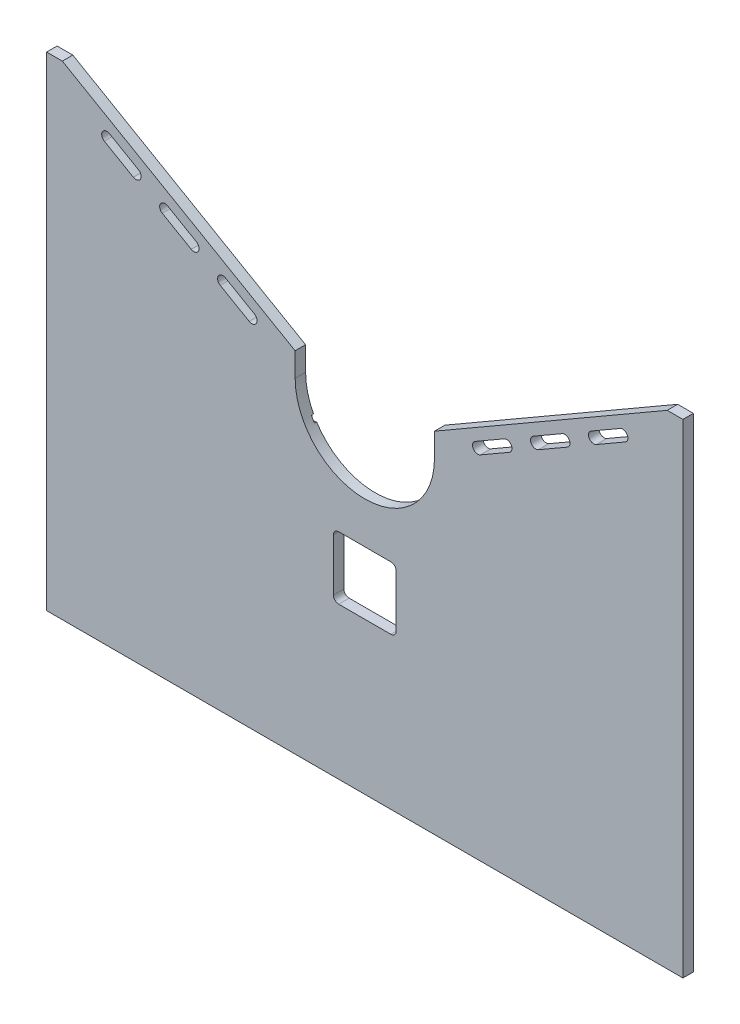
from build123d import *

# Parameters (mm, degrees)
BOSS_EXTRUDE1_DEPTH = 12.7
CUT_EXTRUDE5_DEPTH  = 12.7
SKETCH9_R           = 3.81
CUT_EXTRUDE6_DEPTH  = 2.54
CUT_EXTRUDE7_DEPTH  = 12.7


with BuildPart() as part:
    # Sketch1 → Boss-Extrude1 (new body)
    with BuildSketch(Plane.XY.offset(1081.90385267)):
        with BuildLine():
            Line((779.192327096, 749.508856284), (760.142327096, 749.508856284))
            Line((760.142327096, 749.508856284), (477.497001613, 586.250864284))
            Line((477.497001613, 586.250864284), (477.497001613, 557.307056284))
            ThreePointArc((477.497001613, 557.307056284), (392.915001613, 472.725056284), (308.333001613, 557.307056284))
            Line((308.333001613, 557.307056284), (308.289027096, 586.225464284))
            Line((308.289027096, 586.225464284), (25.599727096, 749.508856284))
            Line((25.599727096, 749.508856284), (6.549727096, 749.508856284))
            Line((6.549727096, 749.508856284), (6.549727096, 162.006856284))
            Line((6.549727096, 162.006856284), (779.192327096, 162.006856284))
            Line((779.192327096, 162.006856284), (779.192327096, 749.508856284))
        make_face()
    extrude(amount=-BOSS_EXTRUDE1_DEPTH)

    # Sketch7 → Cut-Extrude5 (cut)
    with BuildSketch(Plane(origin=(0, 0, 1069.20385267), x_dir=(-1, 0, 0), z_dir=(0, 0, -1))):
        with BuildLine():
            Line((-424.665001613, 346.156856284), (-361.165001613, 346.156856284))
            ThreePointArc((-361.165001613, 346.156856284), (-356.674873552, 348.016728223), (-354.815001613, 352.506856284))
            Line((-354.815001613, 352.506856284), (-354.815001613, 416.006856284))
            ThreePointArc((-354.815001613, 416.006856284), (-356.674873552, 420.496984344), (-361.165001613, 422.356856284))
            Line((-361.165001613, 422.356856284), (-424.665001613, 422.356856284))
            ThreePointArc((-424.665001613, 422.356856284), (-429.155129673, 420.496984344), (-431.015001613, 416.006856284))
            Line((-431.015001613, 416.006856284), (-431.015001613, 352.506856284))
            ThreePointArc((-431.015001613, 352.506856284), (-429.155129673, 348.016728223), (-424.665001613, 346.156856284))
        make_face()
    extrude(amount=-CUT_EXTRUDE5_DEPTH, mode=Mode.SUBTRACT)

    # Sketch9 → Cut-Extrude6 (cut)
    with BuildSketch(Plane(origin=(0, 0, 1069.20385267), x_dir=(-1, 0, 0), z_dir=(0, 0, -1))):
        with Locations((-466.165162315, 515.016056284)):
            Circle(SKETCH9_R)
        with Locations((-319.66484091, 515.016056284)):
            Circle(SKETCH9_R)
    extrude(amount=-CUT_EXTRUDE6_DEPTH, mode=Mode.SUBTRACT)

    # Sketch10 → Cut-Extrude7 (cut)
    with BuildSketch(Plane(origin=(0, 0, 1069.20385267), x_dir=(-1, 0, 0), z_dir=(0, 0, -1))):
        with BuildLine():
            Line((-82.919210129, 701.800959598), (-118.114482539, 681.480959598))
            ThreePointArc((-118.114482539, 681.480959598), (-120.438743853, 672.806698284), (-111.764482539, 670.48243697))
            Line((-111.764482539, 670.48243697), (-76.569210129, 690.80243697))
            ThreePointArc((-76.569210129, 690.80243697), (-74.244948815, 699.476698284), (-82.919210129, 701.800959598))
        make_face()
        with BuildLine():
            Line((-702.910793096, 701.800959598), (-667.715520686, 681.480959598))
            ThreePointArc((-667.715520686, 681.480959598), (-665.391259372, 672.806698284), (-674.065520686, 670.48243697))
            Line((-674.065520686, 670.48243697), (-709.260793096, 690.80243697))
            ThreePointArc((-709.260793096, 690.80243697), (-711.58505441, 699.476698284), (-702.910793096, 701.800959598))
        make_face()
        with BuildLine():
            Line((-153.309754949, 661.160959597), (-188.505027358, 640.840959598))
            ThreePointArc((-188.505027358, 640.840959598), (-190.829288672, 632.166698284), (-182.155027358, 629.84243697))
            Line((-182.155027358, 629.84243697), (-146.959754949, 650.16243697))
            ThreePointArc((-146.959754949, 650.16243697), (-144.635493635, 658.836698283), (-153.309754949, 661.160959597))
        make_face()
        with BuildLine():
            Line((-638.870248276, 650.16243697), (-603.674975867, 629.84243697))
            ThreePointArc((-603.674975867, 629.84243697), (-595.000714553, 632.166698284), (-597.324975867, 640.840959598))
            Line((-597.324975867, 640.840959598), (-632.520248276, 661.160959598))
            ThreePointArc((-632.520248276, 661.160959598), (-641.19450959, 658.836698284), (-638.870248276, 650.16243697))
        make_face()
        with BuildLine():
            Line((-568.479703457, 609.52243697), (-533.284431047, 589.20243697))
            ThreePointArc((-533.284431047, 589.20243697), (-524.610169733, 591.526698284), (-526.934431047, 600.200959598))
            Line((-526.934431047, 600.200959598), (-562.129703457, 620.520959598))
            ThreePointArc((-562.129703457, 620.520959598), (-570.803964771, 618.196698284), (-568.479703457, 609.52243697))
        make_face()
        with BuildLine():
            Line((-223.700299768, 620.520959597), (-258.895572178, 600.200959597))
            ThreePointArc((-258.895572178, 600.200959597), (-261.219833492, 591.526698284), (-252.545572178, 589.20243697))
            Line((-252.545572178, 589.20243697), (-217.350299768, 609.52243697))
            ThreePointArc((-217.350299768, 609.52243697), (-215.026038454, 618.196698283), (-223.700299768, 620.520959597))
        make_face()
    extrude(amount=-CUT_EXTRUDE7_DEPTH, mode=Mode.SUBTRACT)


solid = part.part
